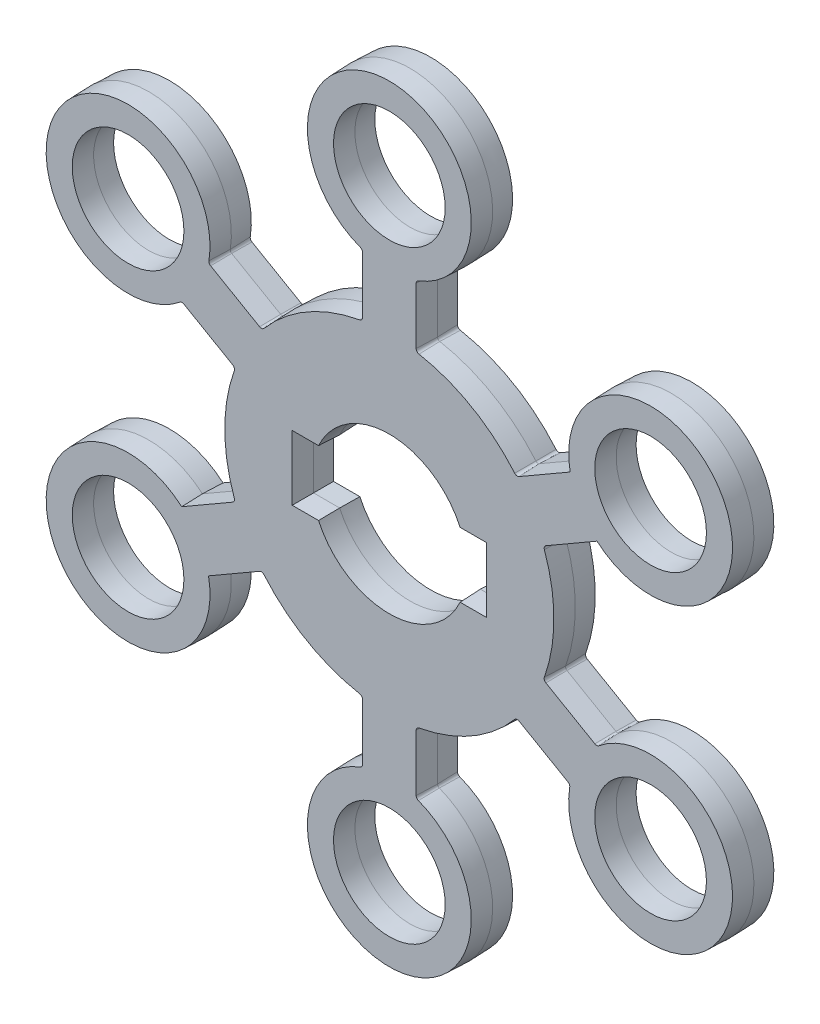
from build123d import *

# Parameters (mm, degrees)
SKETCH1_R                     = 20
BOSS_EXTRUDE1_DEPTH           = 7.5
BOSS_EXTRUDE1_DRAFT           = 2
BOSS_EXTRUDE1_OTHER_WAY_DEPTH = 7.5
BOSS_EXTRUDE1_OTHER_WAY_DRAFT = -2


with BuildPart() as part:
    # Sketch1 → Boss-Extrude1 (with draft: the straight prism first)
    with BuildSketch(Plane.XY):
        with BuildLine():
            Line((-10, 80.517246508), (-10, 60))
            ThreePointArc((-10, 60), (-10.23177872, 59.3598156), (-10.819672131, 59.016393443))
            ThreePointArc((-10.819672131, 59.016393443), (-30, 51.961524227), (-45.699859895, 38.878307648))
            ThreePointArc((-45.699859895, 38.878307648), (-46.291218914, 38.540888098), (-46.961524227, 38.660254038))
            Line((-46.961524227, 38.660254038), (-64.729980918, 48.918877292))
            ThreePointArc((-64.729980918, 48.918877292), (-65.133377741, 49.356097168), (-65.217071267, 49.945067125))
            ThreePointArc((-65.217071267, 49.945067125), (-120.810543828, 69.75), (-75.862232557, 31.507106915))
            ThreePointArc((-75.862232557, 31.507106915), (-75.310322849, 31.729111174), (-74.729980918, 31.598369216))
            Line((-74.729980918, 31.598369216), (-56.961524227, 21.339745962))
            ThreePointArc((-56.961524227, 21.339745962), (-56.522997634, 20.818927502), (-56.519532027, 20.138085795))
            ThreePointArc((-56.519532027, 20.138085795), (-60, 0), (-56.519532027, -20.138085795))
            ThreePointArc((-56.519532027, -20.138085795), (-56.522997634, -20.818927502), (-56.961524227, -21.339745962))
            Line((-56.961524227, -21.339745962), (-75.334884287, -31.947610338))
            ThreePointArc((-75.334884287, -31.947610338), (-120.810543828, -69.75), (-65.334884287, -49.268118414))
            Line((-65.334884287, -49.268118414), (-46.961524227, -38.660254038))
            ThreePointArc((-46.961524227, -38.660254038), (-46.291218914, -38.540888098), (-45.699859895, -38.878307648))
            ThreePointArc((-45.699859895, -38.878307648), (-30, -51.961524227), (-10.819672131, -59.016393443))
            ThreePointArc((-10.819672131, -59.016393443), (-10.23177872, -59.3598156), (-10, -60))
            Line((-10, -60), (-10, -80.517246508))
            ThreePointArc((-10, -80.517246508), (-10.176945108, -81.085208342), (-10.64516129, -81.45217404))
            ThreePointArc((-10.64516129, -81.45217404), (0, -139.5), (10.64516129, -81.45217404))
            ThreePointArc((10.64516129, -81.45217404), (10.176945108, -81.085208342), (10, -80.517246508))
            Line((10, -80.517246508), (10, -60))
            ThreePointArc((10, -60), (10.23177872, -59.3598156), (10.819672131, -59.016393443))
            ThreePointArc((10.819672131, -59.016393443), (30, -51.961524227), (45.699859895, -38.878307648))
            ThreePointArc((45.699859895, -38.878307648), (46.291218914, -38.540888098), (46.961524227, -38.660254038))
            Line((46.961524227, -38.660254038), (64.729980918, -48.918877292))
            ThreePointArc((64.729980918, -48.918877292), (65.133377741, -49.356097168), (65.217071267, -49.945067125))
            ThreePointArc((65.217071267, -49.945067125), (120.810543828, -69.75), (75.862232557, -31.507106915))
            ThreePointArc((75.862232557, -31.507106915), (75.310322849, -31.729111174), (74.729980918, -31.598369216))
            Line((74.729980918, -31.598369216), (56.961524227, -21.339745962))
            ThreePointArc((56.961524227, -21.339745962), (56.522997634, -20.818927502), (56.519532027, -20.138085795))
            ThreePointArc((56.519532027, -20.138085795), (60, 0), (56.519532027, 20.138085795))
            ThreePointArc((56.519532027, 20.138085795), (56.522997634, 20.818927502), (56.961524227, 21.339745962))
            Line((56.961524227, 21.339745962), (75.334884287, 31.947610338))
            ThreePointArc((75.334884287, 31.947610338), (120.810543828, 69.75), (65.334884287, 49.268118414))
            Line((65.334884287, 49.268118414), (46.961524227, 38.660254038))
            ThreePointArc((46.961524227, 38.660254038), (46.291218914, 38.540888098), (45.699859895, 38.878307648))
            ThreePointArc((45.699859895, 38.878307648), (30, 51.961524227), (10.819672131, 59.016393443))
            ThreePointArc((10.819672131, 59.016393443), (10.23177872, 59.3598156), (10, 60))
            Line((10, 60), (10, 80.517246508))
            ThreePointArc((10, 80.517246508), (10.176945108, 81.085208342), (10.64516129, 81.45217404))
            ThreePointArc((10.64516129, 81.45217404), (0, 139.5), (-10.64516129, 81.45217404))
            ThreePointArc((-10.64516129, 81.45217404), (-10.176945108, 81.085208342), (-10, 80.517246508))
        make_face()
        with Locations((0, 109.5)):
            Circle(SKETCH1_R, mode=Mode.SUBTRACT)
        with Locations((94.829781714, 54.75)):
            Circle(SKETCH1_R, mode=Mode.SUBTRACT)
        with Locations((94.829781714, -54.75)):
            Circle(SKETCH1_R, mode=Mode.SUBTRACT)
        with Locations((0, -109.5)):
            Circle(SKETCH1_R, mode=Mode.SUBTRACT)
        with Locations((-94.829781714, -54.75)):
            Circle(SKETCH1_R, mode=Mode.SUBTRACT)
        with Locations((-94.829781714, 54.75)):
            Circle(SKETCH1_R, mode=Mode.SUBTRACT)
        with BuildLine():
            Line((-35, 11.5), (-25.529394822, 11.5))
            ThreePointArc((-25.529394822, 11.5), (0, 28), (25.529394822, 11.5))
            Line((25.529394822, 11.5), (35, 11.5))
            Line((35, 11.5), (35, -11.5))
            Line((35, -11.5), (25.529394822, -11.5))
            ThreePointArc((25.529394822, -11.5), (0, -28), (-25.529394822, -11.5))
            Line((-25.529394822, -11.5), (-35, -11.5))
            Line((-35, -11.5), (-35, 11.5))
        make_face(mode=Mode.SUBTRACT)
    extrude(amount=BOSS_EXTRUDE1_DEPTH)
    # Boss-Extrude1: the draft: its side faces are tilted about the plane it starts from
    boss_extrude1_sides = [part.faces().sort_by_distance(p)[0] for p in [
        (75.310322849, -31.729111174, 3.75),
        (65.845752573, -26.469057589, 3.75),
        (56.522997634, -20.818927502, 3.75),
        (60, 0, 3.75),
        (56.522997634, 20.818927502, 3.75),
        (66.148204257, 26.64367815, 3.75),
        (120.810543828, 69.75, 3.75),
        (56.148204257, 43.964186226, 3.75),
        (46.291218914, 38.540888098, 3.75),
        (30, 51.961524227, 3.75),
        (10.23177872, 59.3598156, 3.75),
        (10, 70.258623254, 3.75),
        (10.176945108, 81.085208342, 3.75),
        (0, 139.5, 3.75),
        (-10.176945108, 81.085208342, 3.75),
        (-10, 70.258623254, 3.75),
        (-10.23177872, 59.3598156, 3.75),
        (-30, 51.961524227, 3.75),
        (-46.291218914, 38.540888098, 3.75),
        (-55.845752573, 43.789565665, 3.75),
        (-65.133377741, 49.356097168, 3.75),
        (-120.810543828, 69.75, 3.75),
        (-75.310322849, 31.729111174, 3.75),
        (-65.845752573, 26.469057589, 3.75),
        (-56.522997634, 20.818927502, 3.75),
        (-60, 0, 3.75),
        (-56.522997634, -20.818927502, 3.75),
        (-66.148204257, -26.64367815, 3.75),
        (-120.810543828, -69.75, 3.75),
        (-56.148204257, -43.964186226, 3.75),
        (-46.291218914, -38.540888098, 3.75),
        (-30, -51.961524227, 3.75),
        (-10.23177872, -59.3598156, 3.75),
        (-10, -70.258623254, 3.75),
        (-10.176945108, -81.085208342, 3.75),
        (0, -139.5, 3.75),
        (10.176945108, -81.085208342, 3.75),
        (10, -70.258623254, 3.75),
        (10.23177872, -59.3598156, 3.75),
        (30, -51.961524227, 3.75),
        (46.291218914, -38.540888098, 3.75),
        (55.845752573, -43.789565665, 3.75),
        (65.133377741, -49.356097168, 3.75),
        (120.810543828, -69.75, 3.75),
        (-20, 109.5, 3.75),
        (74.829781714, 54.75, 3.75),
        (74.829781714, -54.75, 3.75),
        (-20, -109.5, 3.75),
        (-114.829781714, -54.75, 3.75),
        (-114.829781714, 54.75, 3.75),
        (-30.264697411, -11.5, 3.75),
        (-35, 0, 3.75),
        (-30.264697411, 11.5, 3.75),
        (0, 28, 3.75),
        (30.264697411, 11.5, 3.75),
        (35, 0, 3.75),
        (30.264697411, -11.5, 3.75),
        (0, -28, 3.75),
    ]]
    draft(boss_extrude1_sides, Plane.XY, BOSS_EXTRUDE1_DRAFT)


with BuildPart() as boss_extrude1_other_way_tool:
    # Sketch1 → Boss-Extrude1 other way (with draft: the straight prism first)
    with BuildSketch(Plane.XY):
        with BuildLine():
            Line((-10, 80.517246508), (-10, 60))
            ThreePointArc((-10, 60), (-10.23177872, 59.3598156), (-10.819672131, 59.016393443))
            ThreePointArc((-10.819672131, 59.016393443), (-30, 51.961524227), (-45.699859895, 38.878307648))
            ThreePointArc((-45.699859895, 38.878307648), (-46.291218914, 38.540888098), (-46.961524227, 38.660254038))
            Line((-46.961524227, 38.660254038), (-64.729980918, 48.918877292))
            ThreePointArc((-64.729980918, 48.918877292), (-65.133377741, 49.356097168), (-65.217071267, 49.945067125))
            ThreePointArc((-65.217071267, 49.945067125), (-120.810543828, 69.75), (-75.862232557, 31.507106915))
            ThreePointArc((-75.862232557, 31.507106915), (-75.310322849, 31.729111174), (-74.729980918, 31.598369216))
            Line((-74.729980918, 31.598369216), (-56.961524227, 21.339745962))
            ThreePointArc((-56.961524227, 21.339745962), (-56.522997634, 20.818927502), (-56.519532027, 20.138085795))
            ThreePointArc((-56.519532027, 20.138085795), (-60, 0), (-56.519532027, -20.138085795))
            ThreePointArc((-56.519532027, -20.138085795), (-56.522997634, -20.818927502), (-56.961524227, -21.339745962))
            Line((-56.961524227, -21.339745962), (-75.334884287, -31.947610338))
            ThreePointArc((-75.334884287, -31.947610338), (-120.810543828, -69.75), (-65.334884287, -49.268118414))
            Line((-65.334884287, -49.268118414), (-46.961524227, -38.660254038))
            ThreePointArc((-46.961524227, -38.660254038), (-46.291218914, -38.540888098), (-45.699859895, -38.878307648))
            ThreePointArc((-45.699859895, -38.878307648), (-30, -51.961524227), (-10.819672131, -59.016393443))
            ThreePointArc((-10.819672131, -59.016393443), (-10.23177872, -59.3598156), (-10, -60))
            Line((-10, -60), (-10, -80.517246508))
            ThreePointArc((-10, -80.517246508), (-10.176945108, -81.085208342), (-10.64516129, -81.45217404))
            ThreePointArc((-10.64516129, -81.45217404), (0, -139.5), (10.64516129, -81.45217404))
            ThreePointArc((10.64516129, -81.45217404), (10.176945108, -81.085208342), (10, -80.517246508))
            Line((10, -80.517246508), (10, -60))
            ThreePointArc((10, -60), (10.23177872, -59.3598156), (10.819672131, -59.016393443))
            ThreePointArc((10.819672131, -59.016393443), (30, -51.961524227), (45.699859895, -38.878307648))
            ThreePointArc((45.699859895, -38.878307648), (46.291218914, -38.540888098), (46.961524227, -38.660254038))
            Line((46.961524227, -38.660254038), (64.729980918, -48.918877292))
            ThreePointArc((64.729980918, -48.918877292), (65.133377741, -49.356097168), (65.217071267, -49.945067125))
            ThreePointArc((65.217071267, -49.945067125), (120.810543828, -69.75), (75.862232557, -31.507106915))
            ThreePointArc((75.862232557, -31.507106915), (75.310322849, -31.729111174), (74.729980918, -31.598369216))
            Line((74.729980918, -31.598369216), (56.961524227, -21.339745962))
            ThreePointArc((56.961524227, -21.339745962), (56.522997634, -20.818927502), (56.519532027, -20.138085795))
            ThreePointArc((56.519532027, -20.138085795), (60, 0), (56.519532027, 20.138085795))
            ThreePointArc((56.519532027, 20.138085795), (56.522997634, 20.818927502), (56.961524227, 21.339745962))
            Line((56.961524227, 21.339745962), (75.334884287, 31.947610338))
            ThreePointArc((75.334884287, 31.947610338), (120.810543828, 69.75), (65.334884287, 49.268118414))
            Line((65.334884287, 49.268118414), (46.961524227, 38.660254038))
            ThreePointArc((46.961524227, 38.660254038), (46.291218914, 38.540888098), (45.699859895, 38.878307648))
            ThreePointArc((45.699859895, 38.878307648), (30, 51.961524227), (10.819672131, 59.016393443))
            ThreePointArc((10.819672131, 59.016393443), (10.23177872, 59.3598156), (10, 60))
            Line((10, 60), (10, 80.517246508))
            ThreePointArc((10, 80.517246508), (10.176945108, 81.085208342), (10.64516129, 81.45217404))
            ThreePointArc((10.64516129, 81.45217404), (0, 139.5), (-10.64516129, 81.45217404))
            ThreePointArc((-10.64516129, 81.45217404), (-10.176945108, 81.085208342), (-10, 80.517246508))
        make_face()
        with Locations((0, 109.5)):
            Circle(SKETCH1_R, mode=Mode.SUBTRACT)
        with Locations((94.829781714, 54.75)):
            Circle(SKETCH1_R, mode=Mode.SUBTRACT)
        with Locations((94.829781714, -54.75)):
            Circle(SKETCH1_R, mode=Mode.SUBTRACT)
        with Locations((0, -109.5)):
            Circle(SKETCH1_R, mode=Mode.SUBTRACT)
        with Locations((-94.829781714, -54.75)):
            Circle(SKETCH1_R, mode=Mode.SUBTRACT)
        with Locations((-94.829781714, 54.75)):
            Circle(SKETCH1_R, mode=Mode.SUBTRACT)
        with BuildLine():
            Line((-35, 11.5), (-25.529394822, 11.5))
            ThreePointArc((-25.529394822, 11.5), (0, 28), (25.529394822, 11.5))
            Line((25.529394822, 11.5), (35, 11.5))
            Line((35, 11.5), (35, -11.5))
            Line((35, -11.5), (25.529394822, -11.5))
            ThreePointArc((25.529394822, -11.5), (0, -28), (-25.529394822, -11.5))
            Line((-25.529394822, -11.5), (-35, -11.5))
            Line((-35, -11.5), (-35, 11.5))
        make_face(mode=Mode.SUBTRACT)
    extrude(amount=-BOSS_EXTRUDE1_OTHER_WAY_DEPTH)
    # Boss-Extrude1 other way: the draft: its side faces are tilted about the plane it starts from
    boss_extrude1_other_way_sides = [boss_extrude1_other_way_tool.faces().sort_by_distance(p)[0] for p in [
        (75.310322849, -31.729111174, -3.75),
        (65.845752573, -26.469057589, -3.75),
        (56.522997634, -20.818927502, -3.75),
        (60, 0, -3.75),
        (56.522997634, 20.818927502, -3.75),
        (66.148204257, 26.64367815, -3.75),
        (120.810543828, 69.75, -3.75),
        (56.148204257, 43.964186226, -3.75),
        (46.291218914, 38.540888098, -3.75),
        (30, 51.961524227, -3.75),
        (10.23177872, 59.3598156, -3.75),
        (10, 70.258623254, -3.75),
        (10.176945108, 81.085208342, -3.75),
        (0, 139.5, -3.75),
        (-10.176945108, 81.085208342, -3.75),
        (-10, 70.258623254, -3.75),
        (-10.23177872, 59.3598156, -3.75),
        (-30, 51.961524227, -3.75),
        (-46.291218914, 38.540888098, -3.75),
        (-55.845752573, 43.789565665, -3.75),
        (-65.133377741, 49.356097168, -3.75),
        (-120.810543828, 69.75, -3.75),
        (-75.310322849, 31.729111174, -3.75),
        (-65.845752573, 26.469057589, -3.75),
        (-56.522997634, 20.818927502, -3.75),
        (-60, 0, -3.75),
        (-56.522997634, -20.818927502, -3.75),
        (-66.148204257, -26.64367815, -3.75),
        (-120.810543828, -69.75, -3.75),
        (-56.148204257, -43.964186226, -3.75),
        (-46.291218914, -38.540888098, -3.75),
        (-30, -51.961524227, -3.75),
        (-10.23177872, -59.3598156, -3.75),
        (-10, -70.258623254, -3.75),
        (-10.176945108, -81.085208342, -3.75),
        (0, -139.5, -3.75),
        (10.176945108, -81.085208342, -3.75),
        (10, -70.258623254, -3.75),
        (10.23177872, -59.3598156, -3.75),
        (30, -51.961524227, -3.75),
        (46.291218914, -38.540888098, -3.75),
        (55.845752573, -43.789565665, -3.75),
        (65.133377741, -49.356097168, -3.75),
        (120.810543828, -69.75, -3.75),
        (-20, 109.5, -3.75),
        (74.829781714, 54.75, -3.75),
        (74.829781714, -54.75, -3.75),
        (-20, -109.5, -3.75),
        (-114.829781714, -54.75, -3.75),
        (-114.829781714, 54.75, -3.75),
        (-30.264697411, -11.5, -3.75),
        (-35, 0, -3.75),
        (-30.264697411, 11.5, -3.75),
        (0, 28, -3.75),
        (30.264697411, 11.5, -3.75),
        (35, 0, -3.75),
        (30.264697411, -11.5, -3.75),
        (0, -28, -3.75),
    ]]
    draft(boss_extrude1_other_way_sides, Plane.XY, BOSS_EXTRUDE1_OTHER_WAY_DRAFT)


with BuildPart() as part_1:
    add(part.part)

    # Boss-Extrude1 other way: add boss_extrude1_other_way_tool
    add(boss_extrude1_other_way_tool.part)


solid = part_1.part
